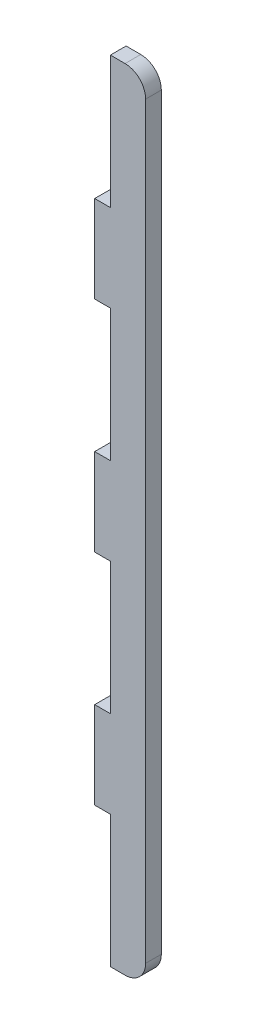
from build123d import *

# Parameters (mm, degrees)
BOSS_EXTRUDE1_DEPTH = 5.35


with BuildPart() as part:
    # Model → Boss-Extrude1 (new body)
    with BuildSketch(Plane.XY):
        with BuildLine():
            Line((0, 149.333), (0, 194.3335))
            Line((0, 194.3335), (-5.35, 194.3335))
            Line((-5.35, 194.3335), (-5.35, 223.9995))
            Line((-5.35, 223.9995), (0, 223.9995))
            Line((0, 223.9995), (0, 269))
            Line((0, 269), (5, 269))
            ThreePointArc((5, 269), (9.949747468, 266.949747468), (12, 262))
            Line((12, 262), (12, 7))
            ThreePointArc((12, 7), (9.949747468, 2.050252532), (5, 0))
            Line((5, 0), (0, 0))
            Line((0, 0), (0, 45.0005))
            Line((0, 45.0005), (-5.35, 45.0005))
            Line((-5.35, 45.0005), (-5.35, 74.6665))
            Line((-5.35, 74.6665), (0, 74.6665))
            Line((0, 74.6665), (0, 119.667))
            Line((0, 119.667), (-5.35, 119.667))
            Line((-5.35, 119.667), (-5.35, 149.333))
            Line((-5.35, 149.333), (0, 149.333))
        make_face()
    extrude(amount=BOSS_EXTRUDE1_DEPTH)


solid = part.part
